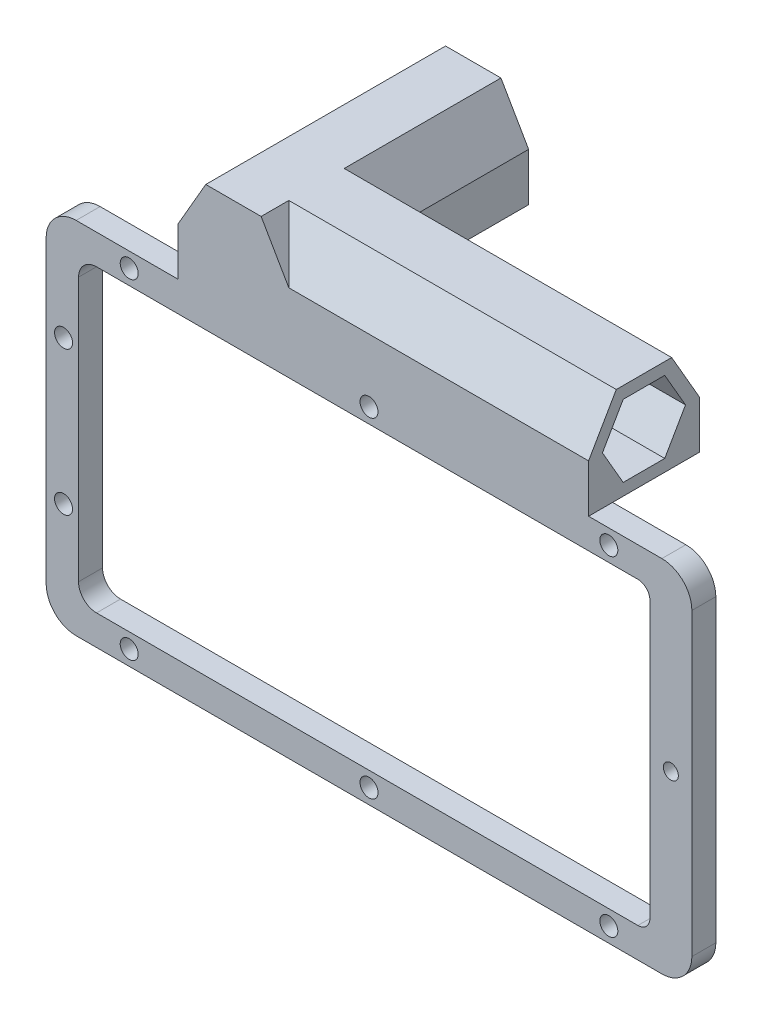
from build123d import *

# Parameters (mm, degrees)
SKETCH3_R           = 1.5
SKETCH3_R_2         = 1.25
BOSS_EXTRUDE1_DEPTH = 4
BOSS_EXTRUDE2_DEPTH = 40
BOSS_EXTRUDE5_DEPTH = 50
BOSS_EXTRUDE6_REACH = 91.057
CUT_EXTRUDE2_DEPTH  = 90.057130972
BOSS_EXTRUDE7_DEPTH = 2.3094


with BuildPart() as part:
    # Sketch3 → Boss-Extrude1 (new body)
    with BuildSketch(Plane.XY):
        with BuildLine():
            Line((-53.55, 25), (-53.55, -25))
            ThreePointArc((-53.55, -25), (-52.085533906, -28.535533906), (-48.55, -30))
            Line((-48.55, -30), (49.15, -30))
            ThreePointArc((49.15, -30), (52.685533906, -28.535533906), (54.15, -25))
            Line((54.15, -25), (54.15, 25))
            ThreePointArc((54.15, 25), (52.685533906, 28.535533906), (49.15, 30))
            Line((49.15, 30), (-48.55, 30))
            ThreePointArc((-48.55, 30), (-52.085533906, 28.535533906), (-53.55, 25))
        make_face()
        with Locations((-39.7, 27.5)):
            Circle(SKETCH3_R, mode=Mode.SUBTRACT)
        with Locations((40.3, 27.5)):
            Circle(SKETCH3_R, mode=Mode.SUBTRACT)
        with Locations((40.3, -27.5)):
            Circle(SKETCH3_R, mode=Mode.SUBTRACT)
        with Locations((0.3, -27.5)):
            Circle(SKETCH3_R, mode=Mode.SUBTRACT)
        with Locations((-50.65, -12)):
            Circle(SKETCH3_R, mode=Mode.SUBTRACT)
        with Locations((-50.65, 12)):
            Circle(SKETCH3_R, mode=Mode.SUBTRACT)
        with Locations((-39.7, -27.5)):
            Circle(SKETCH3_R, mode=Mode.SUBTRACT)
        with Locations((0.3, 27.5)):
            Circle(SKETCH3_R, mode=Mode.SUBTRACT)
        with Locations((50.65, 0)):
            Circle(SKETCH3_R_2, mode=Mode.SUBTRACT)
        with BuildLine():
            Line((-48.15, 22), (-48.15, -22))
            ThreePointArc((-48.15, -22), (-47.271320344, -24.121320344), (-45.15, -25))
            Line((-45.15, -25), (45.15, -25))
            ThreePointArc((45.15, -25), (46.564213562, -24.414213562), (47.15, -23))
            Line((47.15, -23), (47.15, 23))
            ThreePointArc((47.15, 23), (46.564213562, 24.414213562), (45.15, 25))
            Line((45.15, 25), (-45.15, 25))
            ThreePointArc((-45.15, 25), (-47.271320344, 24.121320344), (-48.15, 22))
        make_face(mode=Mode.SUBTRACT)
    extrude(amount=BOSS_EXTRUDE1_DEPTH)

    # Sketch5 → Boss-Extrude2 (add)
    # profile 1 of 3: a face of its own
    with BuildSketch(Plane.XY.offset(4)):
        Polygon((-17.693593539, 30), (-13.074791386, 38), (-17.693593539, 46), (-26.931197846, 46), (-31.55, 38), (-26.931197846, 30), align=None)
        Polygon((-18.848294078, 44), (-15.384192463, 38), (-18.848294078, 32), (-25.776497308, 32), (-29.240598923, 38), (-25.776497308, 44), align=None, mode=Mode.SUBTRACT)
    # profile 2 of 3: a face of its own
    with BuildSketch(Plane.XY.offset(4)):
        Polygon((-13.074791386, 30), (-13.074791386, 38), (-17.693593539, 30), align=None)
    # profile 3 of 3: a face of its own
    with BuildSketch(Plane.XY.offset(4)):
        Polygon((-31.55, 30), (-26.931197846, 30), (-31.55, 38), align=None)
    extrude(amount=-BOSS_EXTRUDE2_DEPTH)

    # Sketch8 → Boss-Extrude5 (add)
    with BuildSketch(Plane(origin=(-13.074791386, 0, 0), x_dir=(0, 0, -1), z_dir=(1, 0, 0))):
        Polygon((0, 30), (0.618802154, 30), (-4, 38), (-4, 30), align=None)
        Polygon((9.856406461, 30), (14.475208614, 38), (12.165807537, 38), (8.701705922, 32), (1.773502692, 32), (-1.690598923, 38), (-4, 38), (0.618802154, 30), align=None)
        Polygon((14.475208614, 30), (14.475208614, 38), (9.856406461, 30), align=None)
        Polygon((12.165807537, 38), (14.475208614, 38), (9.856406461, 46), (0.618802154, 46), (-4, 38), (-1.690598923, 38), (1.773502692, 44), (8.701705922, 44), align=None)
    extrude(amount=BOSS_EXTRUDE5_DEPTH)

    # Boss-Extrude6: up to this face of the body (flat: up to its plane)
    boss_extrude6_end = Plane(part.part.faces().sort_by_distance((-15.384192463, 42, -16))[0])
    # Sketch8<3> → Boss-Extrude6 (add, up to the picked face)
    with BuildSketch(Plane(origin=(-13.074791386, 0, 0), x_dir=(0, 0, -1), z_dir=(1, 0, 0)), mode=Mode.PRIVATE) as boss_extrude6_sk1:
        Polygon((12.165807537, 38), (14.475208614, 38), (9.856406461, 46), (0.618802154, 46), (-4, 38), (-1.690598923, 38), (1.773502692, 44), (8.701705922, 44), align=None)
    boss_extrude6_tool1 = split(extrude(boss_extrude6_sk1.sketch, amount=-BOSS_EXTRUDE6_REACH, mode=Mode.PRIVATE), bisect_by=boss_extrude6_end, keep=Keep.BOTH, mode=Mode.PRIVATE)
    add(boss_extrude6_tool1.solids().sort_by(Axis((-13.074791, 38.201329, -13.320508), (-1, 0, 0)))[0])

    # Sketch8<4> → Cut-Extrude2 (cut, through all)
    with BuildSketch(Plane(origin=(-13.074791386, 0, 0), x_dir=(0, 0, -1), z_dir=(1, 0, 0))):
        Polygon((-1.690598923, 38), (12.165807537, 38), (8.701705922, 44), (1.773502692, 44), align=None)
        Polygon((8.701705922, 32), (12.165807537, 38), (-1.690598923, 38), (1.773502692, 32), align=None)
    extrude(amount=-CUT_EXTRUDE2_DEPTH, mode=Mode.SUBTRACT)

    # Sketch5<3> → Boss-Extrude7 (add)
    with BuildSketch(Plane.XY.offset(4)):
        Polygon((-25.776497308, 32), (-18.848294078, 32), (-15.384192463, 38), (-18.848294078, 44), (-25.776497308, 44), (-29.240598923, 38), align=None)
    extrude(amount=-BOSS_EXTRUDE7_DEPTH)


solid = part.part
